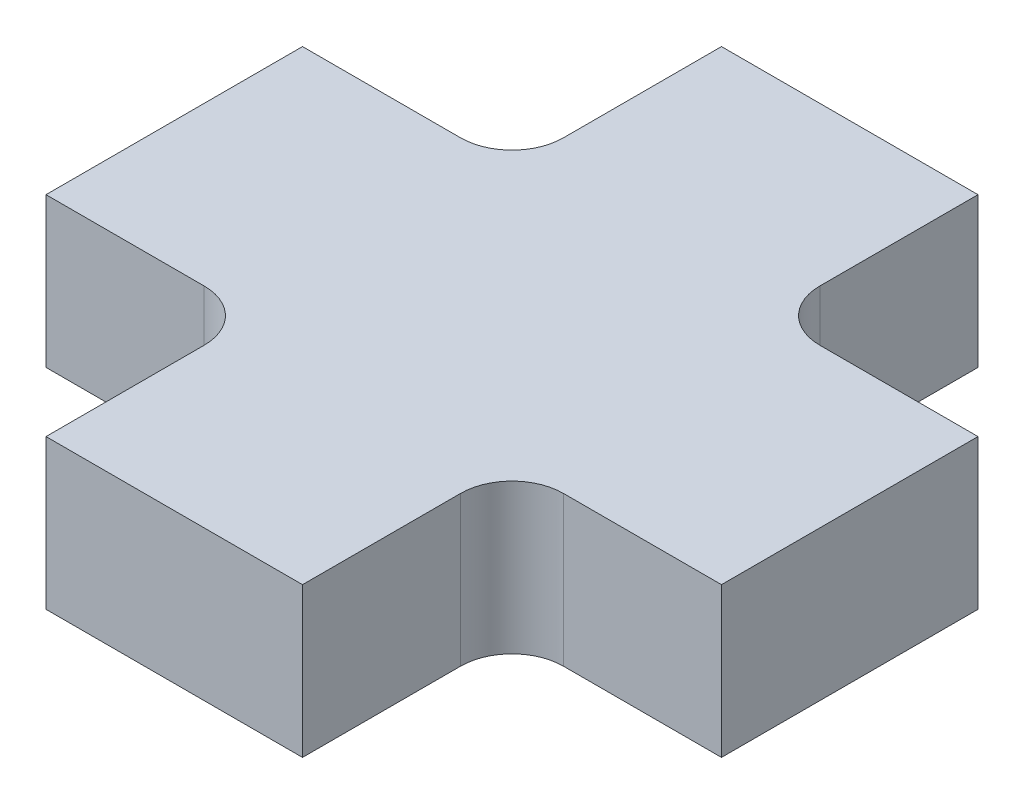
from build123d import *

# Parameters (mm, degrees)
BOSS_EXTRUDE1_DEPTH = 4.445
FILLET1_R           = 1.524


with BuildPart() as part:
    # Sketch1 → Boss-Extrude1 (new body)
    with BuildSketch(Plane(origin=(0, 0, 0), x_dir=(1, 0, 0), z_dir=(0, 1, 0))):
        Polygon((0, 0), (0, 7.62), (6.223, 7.62), (6.223, 13.843), (13.843, 13.843), (13.843, 7.62), (20.066, 7.62), (20.066, 0), (13.843, 0), (13.843, -6.223), (6.223, -6.223), (6.223, 0), align=None)
    extrude(amount=BOSS_EXTRUDE1_DEPTH)

    # Fillet1
    fillet1_edges = [part.edges().sort_by_distance(p)[0] for p in [
        (6.223, 2.2225, -7.62),
        (13.843, 2.2225, -7.62),
        (13.843, 2.2225, 0),
        (6.223, 2.2225, 0),
    ]]
    fillet(fillet1_edges, radius=FILLET1_R)


solid = part.part
